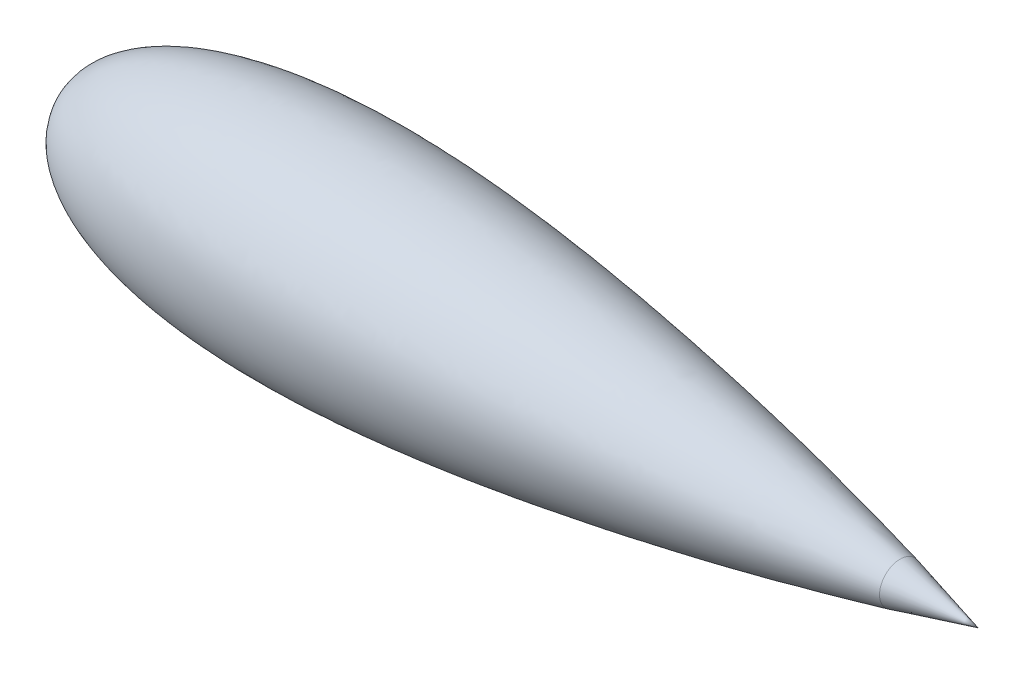
from build123d import *

# Parameters (mm, degrees)
CUT_EXTRUDE1_DEPTH      = 12
CUT_EXTRUDE1_DEPTH_BACK = 56.869113742
SKETCH5_R               = 2.1


with BuildPart() as part:
    # Sketch3 → Revolve2 (revolve)
    with BuildSketch(Plane.XY):
        with BuildLine():
            Line((-1.2, 0), (0, 0))
            add(Edge.make_bspline(
                [(50, 0.1106), (49.16719445, 0.311191457), (47.504036885, 0.711783406), (44.174019643, 1.456934223), (40.010927106, 2.31247348), (35.010160956, 3.224397804), (30.010328611, 4.015390931), (25.010392224, 4.661947433), (20.008909429, 5.121472646), (15.834270935, 5.283409693), (12.497243037, 5.219689649), (9.991780073, 5.046170407), (7.479866613, 4.712001339), (5.390696225, 4.243082538), (3.726003061, 3.688643877), (2.448139945, 3.122975707), (1.381123298, 2.445499898), (0.385297698, 1.482939967), (0, 0.592842082), (0, 0)],
                knots=[0, 0, 0, 0, 0.024527345, 0.04898243, 0.097702931, 0.146209788, 0.194518753, 0.242628743, 0.290539866, 0.338290353, 0.36215648, 0.386078089, 0.410162485, 0.434657726, 0.447250001, 0.460342159, 0.47462366, 0.483098306, 0.5, 0.5, 0.5, 0.5], degree=3))
            Line((50, 0.1106), (50.45367429, 0))
            Line((50.45367429, 0), (55.119085664, 0))
            Line((55.119085664, 0), (50.280998647, 1.277236087))
            add(Edge.make_bspline(
                [(50.280998647, 1.277236087), (48.147896407, 1.791019991), (43.870577432, 2.773786471), (37.407927171, 4.032747244), (30.911041321, 5.111817887), (25.457927784, 5.820978318), (21.064184693, 6.223891391), (17.75050566, 6.419669136), (14.420491339, 6.47876551), (11.070793449, 6.358561561), (8.271149528, 6.053038371), (6.029002711, 5.624862658), (4.353917508, 5.181640752), (2.694194526, 4.582275468), (1.318376128, 3.859197799), (0.293556689, 3.085076962), (-0.463457377, 2.28749832), (-0.935055128, 1.42283027), (-1.156618104, 0.642748024), (-1.2, 0.211793679), (-1.2, 0)],
                knots=[0, 0, 0, 0, 0.0625, 0.125, 0.1875, 0.25, 0.28125, 0.3125, 0.34375, 0.375, 0.40625, 0.421875, 0.4375, 0.453125, 0.46875, 0.4765625, 0.484375, 0.4921875, 0.49609375, 0.5, 0.5, 0.5, 0.5], degree=3))
        make_face()
    revolve(axis=Axis((-5.137160705, 0, 0), (1, 0, 0)))

    # Sketch5 → Cut-Extrude1 (cut, two sides: drawn at the far end of the back side and taken through both)
    with BuildSketch(Plane(origin=(0, 0, 0), x_dir=(0, 0, -1), z_dir=(1, 0, 0)).offset(-CUT_EXTRUDE1_DEPTH_BACK)):
        Circle(SKETCH5_R)
    extrude(amount=CUT_EXTRUDE1_DEPTH + CUT_EXTRUDE1_DEPTH_BACK, mode=Mode.SUBTRACT)


solid = part.part
